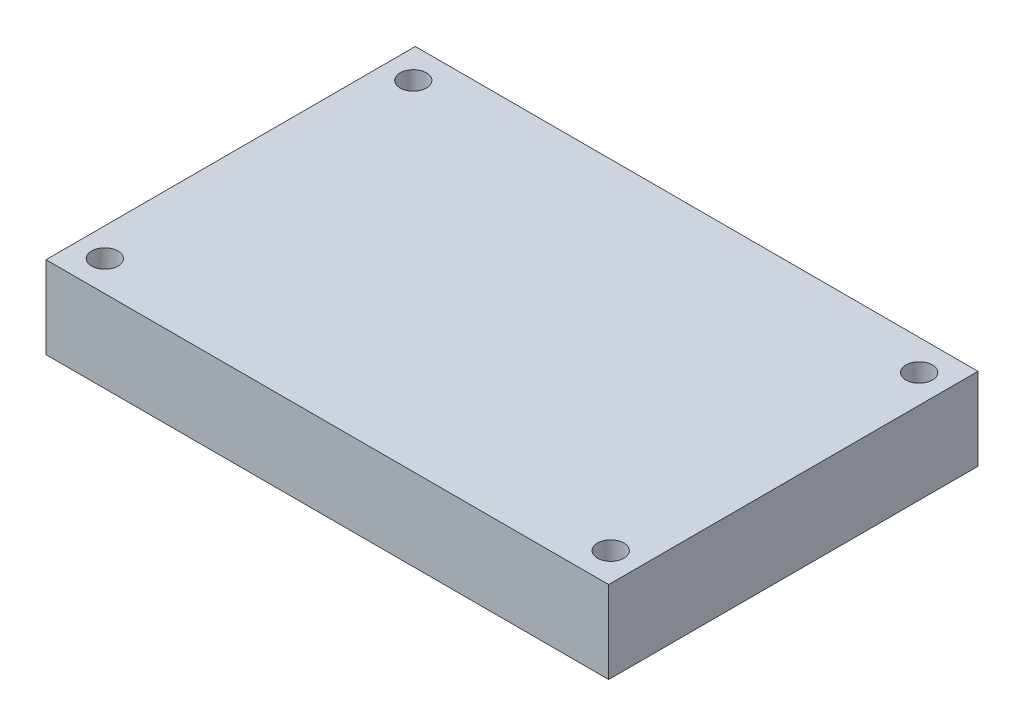
from build123d import *

# Parameters (mm, degrees)
SKETCH1_W           = 68.4
SKETCH1_H           = 44.9
BOSS_EXTRUDE1_DEPTH = 10
CUT_EXTRUDE1_REACH  = 44.115
SKETCH2_R           = 1.6


with BuildPart() as part:
    # Sketch1 → Boss-Extrude1 (new body)
    with BuildSketch(Plane(origin=(0, 0, 0), x_dir=(1, 0, 0), z_dir=(0, 1, 0))):
        Rectangle(SKETCH1_W, SKETCH1_H)
    extrude(amount=BOSS_EXTRUDE1_DEPTH)

    # Sketch2 → Cut-Extrude1 (cut, up to next)
    with BuildSketch(Plane(origin=(0, 0, 0), x_dir=(1, 0, 0), z_dir=(0, 1, 0)), mode=Mode.PRIVATE) as cut_extrude1_sk1:
        with Locations(Location((30.75, 18.75, 0), (0, 0, 270))):
            Circle(SKETCH2_R)
    cut_extrude1_tool1 = extrude(cut_extrude1_sk1.sketch, amount=CUT_EXTRUDE1_REACH, mode=Mode.PRIVATE) & part.part
    # Sketch2 → Cut-Extrude1 (cut, up to next)
    with BuildSketch(Plane(origin=(0, 0, 0), x_dir=(1, 0, 0), z_dir=(0, 1, 0)), mode=Mode.PRIVATE) as cut_extrude1_sk2:
        with Locations(Location((30.75, -18.75, 0), (0, 0, 270))):
            Circle(SKETCH2_R)
    cut_extrude1_tool2 = extrude(cut_extrude1_sk2.sketch, amount=CUT_EXTRUDE1_REACH, mode=Mode.PRIVATE) & part.part
    # Sketch2 → Cut-Extrude1 (cut, up to next)
    with BuildSketch(Plane(origin=(0, 0, 0), x_dir=(1, 0, 0), z_dir=(0, 1, 0)), mode=Mode.PRIVATE) as cut_extrude1_sk3:
        with Locations(Location((-30.75, -18.75, 0), (0, 0, 270))):
            Circle(SKETCH2_R)
    cut_extrude1_tool3 = extrude(cut_extrude1_sk3.sketch, amount=CUT_EXTRUDE1_REACH, mode=Mode.PRIVATE) & part.part
    # Sketch2 → Cut-Extrude1 (cut, up to next)
    with BuildSketch(Plane(origin=(0, 0, 0), x_dir=(1, 0, 0), z_dir=(0, 1, 0)), mode=Mode.PRIVATE) as cut_extrude1_sk4:
        with Locations(Location((-30.75, 18.75, 0), (0, 0, 270))):
            Circle(SKETCH2_R)
    cut_extrude1_tool4 = extrude(cut_extrude1_sk4.sketch, amount=CUT_EXTRUDE1_REACH, mode=Mode.PRIVATE) & part.part
    add(cut_extrude1_tool1.solids().sort_by_distance((30.75, 0, -18.75))[0], mode=Mode.SUBTRACT)
    add(cut_extrude1_tool2.solids().sort_by_distance((30.75, 0, 18.75))[0], mode=Mode.SUBTRACT)
    add(cut_extrude1_tool3.solids().sort_by_distance((-30.75, 0, 18.75))[0], mode=Mode.SUBTRACT)
    add(cut_extrude1_tool4.solids().sort_by_distance((-30.75, 0, -18.75))[0], mode=Mode.SUBTRACT)


solid = part.part
